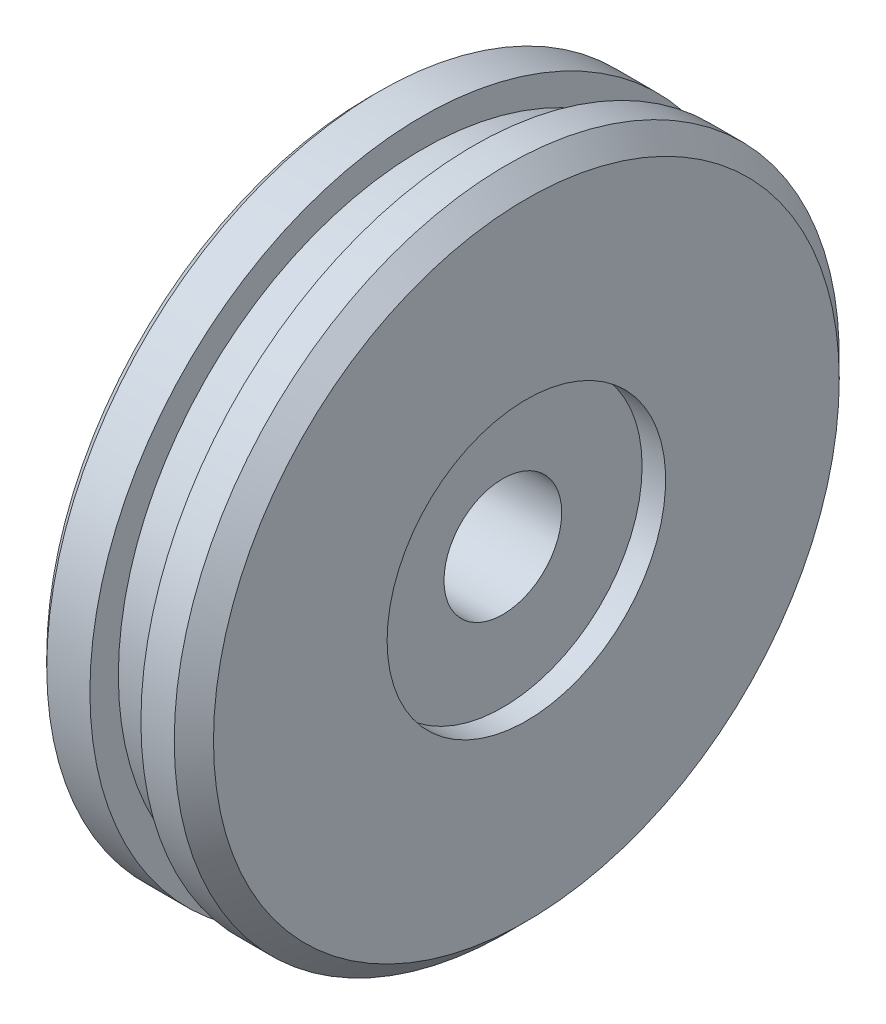
from build123d import *

# Parameters (mm, degrees)
SKETCH2_W            = 2.6
SKETCH2_H            = 2.45
BOSS_EXTRUDE1_START  = 62.7
SKETCH3_W            = 2.3
SKETCH3_H            = 23
BOSS_EXTRUDE1_DEPTH  = 6.6
BOSS_EXTRUDE2_START  = 54.5
SKETCH4_W            = 2.3
SKETCH4_H            = 6.6
BOSS_EXTRUDE2_DEPTH  = 23
BOSS_EXTRUDE3_START  = 76.7
SKETCH5_R            = 4.6
BOSS_EXTRUDE3_DEPTH  = 2.3
BOSS_EXTRUDE4_START  = 84
SKETCH6_R            = 7.1
BOSS_EXTRUDE4_DEPTH  = 1.7
BOSS_EXTRUDE5_START  = 78.9
SKETCH7_R            = 3
BOSS_EXTRUDE5_DEPTH  = 5.2
BOSS_EXTRUDE6_START  = 65.1
SKETCH8_W            = 4.1
SKETCH8_H            = 2.1
BOSS_EXTRUDE6_DEPTH  = 1.8
BOSS_EXTRUDE7_START  = 71.5
SKETCH9_W            = 4.1
SKETCH9_H            = 1.8
BOSS_EXTRUDE7_DEPTH  = 2.1
BOSS_EXTRUDE8_START  = 65.1
SKETCH10_W           = 4.1
SKETCH10_H           = 2.1
BOSS_EXTRUDE8_DEPTH  = 1.8
BOSS_EXTRUDE9_START  = 58.4
SKETCH11_W           = 4.1
SKETCH11_H           = 1.8
BOSS_EXTRUDE9_DEPTH  = 2.1
BOSS_EXTRUDE10_START = 65.1
SKETCH12_W           = 5.3
SKETCH12_H           = 2.4
BOSS_EXTRUDE10_DEPTH = 1.8
BOSS_EXTRUDE11_START = 73.6
SKETCH13_W           = 5.3
SKETCH13_H           = 1.8
BOSS_EXTRUDE11_DEPTH = 2.4
BOSS_EXTRUDE12_START = 65.1
SKETCH14_W           = 5.3
SKETCH14_H           = 2.4
BOSS_EXTRUDE12_DEPTH = 1.8
BOSS_EXTRUDE13_START = 56
SKETCH15_W           = 5.3
SKETCH15_H           = 1.8
BOSS_EXTRUDE13_DEPTH = 2.4


with BuildPart() as part:
    # Sketch1 → Revolve1 (revolve)
    with BuildSketch(Plane.XY.offset(66)):
        Polygon((77.2, -65), (85.2, -65), (85.2, -49.05), (84.2, -48.05), (77.7, -48.05), (77.2, -48.55), align=None)
    revolve(axis=Axis((72.2, -65, 66), (1, 0, 0)))


with BuildPart() as body_2:
    # Sketch2 → Revolve2 (revolve)
    with BuildSketch(Plane.XY.offset(66)):
        with Locations((81.2, -48.275)):
            Rectangle(SKETCH2_W, SKETCH2_H)
    revolve(axis=Axis((74.9, -65, 66), (1, 0, 0)))


with BuildPart() as part_1:
    add(part.part)

    # Combine1: cut body 2
    add(body_2.part, mode=Mode.SUBTRACT)


with BuildPart() as body_2_2:
    # Sketch3 → Boss-Extrude1 (new body)
    with BuildSketch(Plane.XY.offset(BOSS_EXTRUDE1_START)):
        with Locations((77.85, -65)):
            Rectangle(SKETCH3_W, SKETCH3_H)
    extrude(amount=BOSS_EXTRUDE1_DEPTH)


with BuildPart() as part_2:
    add(part_1.part)

    # Combine2: cut body 2 2
    add(body_2_2.part, mode=Mode.SUBTRACT)


with BuildPart() as body_2_3:
    # Sketch4 → Boss-Extrude2 (new body)
    with BuildSketch(Plane.XY.offset(BOSS_EXTRUDE2_START)):
        with Locations((77.85, -65)):
            Rectangle(SKETCH4_W, SKETCH4_H)
    extrude(amount=BOSS_EXTRUDE2_DEPTH)


with BuildPart() as part_3:
    add(part_2.part)

    # Combine3: cut body 2 3
    add(body_2_3.part, mode=Mode.SUBTRACT)


with BuildPart() as body_2_4:
    # Sketch5 → Boss-Extrude3 (new body)
    with BuildSketch(Plane(origin=(0, 0, 0), x_dir=(0, 0, -1), z_dir=(1, 0, 0)).offset(BOSS_EXTRUDE3_START)):
        with Locations((-66, -65)):
            Circle(SKETCH5_R)
    extrude(amount=BOSS_EXTRUDE3_DEPTH)


with BuildPart() as part_4:
    add(part_3.part)

    # Combine4: cut body 2 4
    add(body_2_4.part, mode=Mode.SUBTRACT)


with BuildPart() as body_2_5:
    # Sketch6 → Boss-Extrude4 (new body)
    with BuildSketch(Plane(origin=(0, 0, 0), x_dir=(0, 0, -1), z_dir=(1, 0, 0)).offset(BOSS_EXTRUDE4_START)):
        with Locations((-66, -65)):
            Circle(SKETCH6_R)
    extrude(amount=BOSS_EXTRUDE4_DEPTH)


with BuildPart() as part_5:
    add(part_4.part)

    # Combine5: cut body 2 5
    add(body_2_5.part, mode=Mode.SUBTRACT)


with BuildPart() as body_2_6:
    # Sketch7 → Boss-Extrude5 (new body)
    with BuildSketch(Plane(origin=(0, 0, 0), x_dir=(0, 0, -1), z_dir=(1, 0, 0)).offset(BOSS_EXTRUDE5_START)):
        with Locations((-66, -65)):
            Circle(SKETCH7_R)
    extrude(amount=BOSS_EXTRUDE5_DEPTH)


with BuildPart() as part_6:
    add(part_5.part)

    # Combine6: cut body 2 6
    add(body_2_6.part, mode=Mode.SUBTRACT)


with BuildPart() as body_2_7:
    # Sketch8 → Boss-Extrude6 (new body)
    with BuildSketch(Plane.XY.offset(BOSS_EXTRUDE6_START)):
        with Locations((80.95, -58.45)):
            Rectangle(SKETCH8_W, SKETCH8_H)
    extrude(amount=BOSS_EXTRUDE6_DEPTH)


with BuildPart() as part_7:
    add(part_6.part)

    # Combine7: cut body 2 7
    add(body_2_7.part, mode=Mode.SUBTRACT)


with BuildPart() as body_2_8:
    # Sketch9 → Boss-Extrude7 (new body)
    with BuildSketch(Plane.XY.offset(BOSS_EXTRUDE7_START)):
        with Locations((80.95, -65)):
            Rectangle(SKETCH9_W, SKETCH9_H)
    extrude(amount=BOSS_EXTRUDE7_DEPTH)


with BuildPart() as part_8:
    add(part_7.part)

    # Combine8: cut body 2 8
    add(body_2_8.part, mode=Mode.SUBTRACT)


with BuildPart() as body_2_9:
    # Sketch10 → Boss-Extrude8 (new body)
    with BuildSketch(Plane.XY.offset(BOSS_EXTRUDE8_START)):
        with Locations((80.95, -71.55)):
            Rectangle(SKETCH10_W, SKETCH10_H)
    extrude(amount=BOSS_EXTRUDE8_DEPTH)


with BuildPart() as part_9:
    add(part_8.part)

    # Combine9: cut body 2 9
    add(body_2_9.part, mode=Mode.SUBTRACT)


with BuildPart() as body_2_10:
    # Sketch11 → Boss-Extrude9 (new body)
    with BuildSketch(Plane.XY.offset(BOSS_EXTRUDE9_START)):
        with Locations((80.95, -65)):
            Rectangle(SKETCH11_W, SKETCH11_H)
    extrude(amount=BOSS_EXTRUDE9_DEPTH)


with BuildPart() as part_10:
    add(part_9.part)

    # Combine10: cut body 2 10
    add(body_2_10.part, mode=Mode.SUBTRACT)


with BuildPart() as body_2_11:
    # Sketch12 → Boss-Extrude10 (new body)
    with BuildSketch(Plane.XY.offset(BOSS_EXTRUDE10_START)):
        with Locations((81.55, -56.2)):
            Rectangle(SKETCH12_W, SKETCH12_H)
    extrude(amount=BOSS_EXTRUDE10_DEPTH)


with BuildPart() as part_11:
    add(part_10.part)

    # Combine11: cut body 2 11
    add(body_2_11.part, mode=Mode.SUBTRACT)


with BuildPart() as body_2_12:
    # Sketch13 → Boss-Extrude11 (new body)
    with BuildSketch(Plane.XY.offset(BOSS_EXTRUDE11_START)):
        with Locations((81.55, -65)):
            Rectangle(SKETCH13_W, SKETCH13_H)
    extrude(amount=BOSS_EXTRUDE11_DEPTH)


with BuildPart() as part_12:
    add(part_11.part)

    # Combine12: cut body 2 12
    add(body_2_12.part, mode=Mode.SUBTRACT)


with BuildPart() as body_2_13:
    # Sketch14 → Boss-Extrude12 (new body)
    with BuildSketch(Plane.XY.offset(BOSS_EXTRUDE12_START)):
        with Locations((81.55, -73.8)):
            Rectangle(SKETCH14_W, SKETCH14_H)
    extrude(amount=BOSS_EXTRUDE12_DEPTH)


with BuildPart() as part_13:
    add(part_12.part)

    # Combine13: cut body 2 13
    add(body_2_13.part, mode=Mode.SUBTRACT)


with BuildPart() as body_2_14:
    # Sketch15 → Boss-Extrude13 (new body)
    with BuildSketch(Plane.XY.offset(BOSS_EXTRUDE13_START)):
        with Locations((81.55, -65)):
            Rectangle(SKETCH15_W, SKETCH15_H)
    extrude(amount=BOSS_EXTRUDE13_DEPTH)


with BuildPart() as part_14:
    add(part_13.part)

    # Combine14: cut body 2 14
    add(body_2_14.part, mode=Mode.SUBTRACT)


solid = part_14.part
